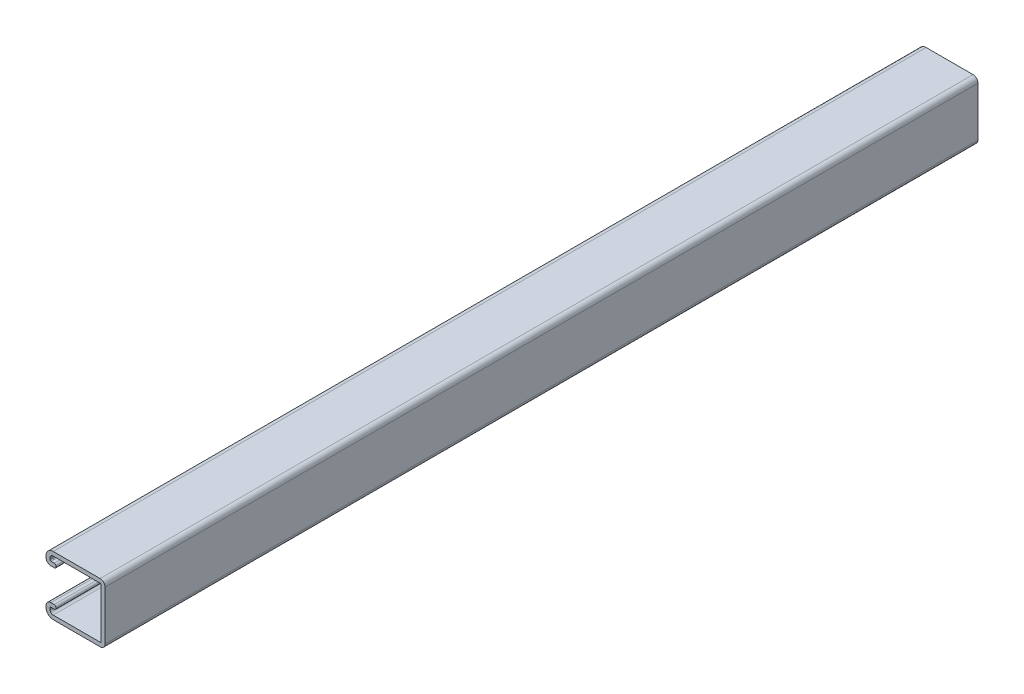
from build123d import *

# Parameters (mm, degrees)
BOSS_EXTRUDE1_DEPTH = 609.6


with BuildPart() as part:
    # Sketch1 → Boss-Extrude1 (new body)
    with BuildSketch(Plane.XY):
        with BuildLine():
            Line((-36.22675, 20.6375), (-3.46075, 20.6375))
            ThreePointArc((-3.46075, 20.6375), (-1.013630207, 19.623869793), (0, 17.17675))
            Line((0, 17.17675), (0, -17.17675))
            ThreePointArc((0, -17.17675), (-1.013630207, -19.623869793), (-3.46075, -20.6375))
            Line((-3.46075, -20.6375), (-36.22675, -20.6375))
            ThreePointArc((-36.22675, -20.6375), (-39.796401808, -19.158901808), (-41.275, -15.58925))
            Line((-41.275, -15.58925), (-41.275, -14.57325))
            ThreePointArc((-41.275, -14.57325), (-40.261369793, -12.126130207), (-37.81425, -11.1125))
            Line((-37.81425, -11.1125), (-35.5346, -11.1125))
            ThreePointArc((-35.5346, -11.1125), (-34.1376, -12.5095), (-35.5346, -13.9065))
            Line((-35.5346, -13.9065), (-37.81425, -13.9065))
            ThreePointArc((-37.81425, -13.9065), (-38.285713446, -14.101786554), (-38.481, -14.57325))
            Line((-38.481, -14.57325), (-38.481, -15.58925))
            ThreePointArc((-38.481, -15.58925), (-37.820745461, -17.183245461), (-36.22675, -17.8435))
            Line((-36.22675, -17.8435), (-3.46075, -17.8435))
            ThreePointArc((-3.46075, -17.8435), (-2.989286554, -17.648213446), (-2.794, -17.17675))
            Line((-2.794, -17.17675), (-2.794, 17.17675))
            ThreePointArc((-2.794, 17.17675), (-2.989286554, 17.648213446), (-3.46075, 17.8435))
            Line((-3.46075, 17.8435), (-36.22675, 17.8435))
            ThreePointArc((-36.22675, 17.8435), (-37.820745461, 17.183245461), (-38.481, 15.58925))
            Line((-38.481, 15.58925), (-38.481, 14.57325))
            ThreePointArc((-38.481, 14.57325), (-38.285713446, 14.101786554), (-37.81425, 13.9065))
            Line((-37.81425, 13.9065), (-35.5346, 13.9065))
            ThreePointArc((-35.5346, 13.9065), (-34.1376, 12.5095), (-35.5346, 11.1125))
            Line((-35.5346, 11.1125), (-37.81425, 11.1125))
            ThreePointArc((-37.81425, 11.1125), (-40.261369793, 12.126130207), (-41.275, 14.57325))
            Line((-41.275, 14.57325), (-41.275, 15.58925))
            ThreePointArc((-41.275, 15.58925), (-39.796401808, 19.158901808), (-36.22675, 20.6375))
        make_face()
    extrude(amount=-BOSS_EXTRUDE1_DEPTH)


solid = part.part
